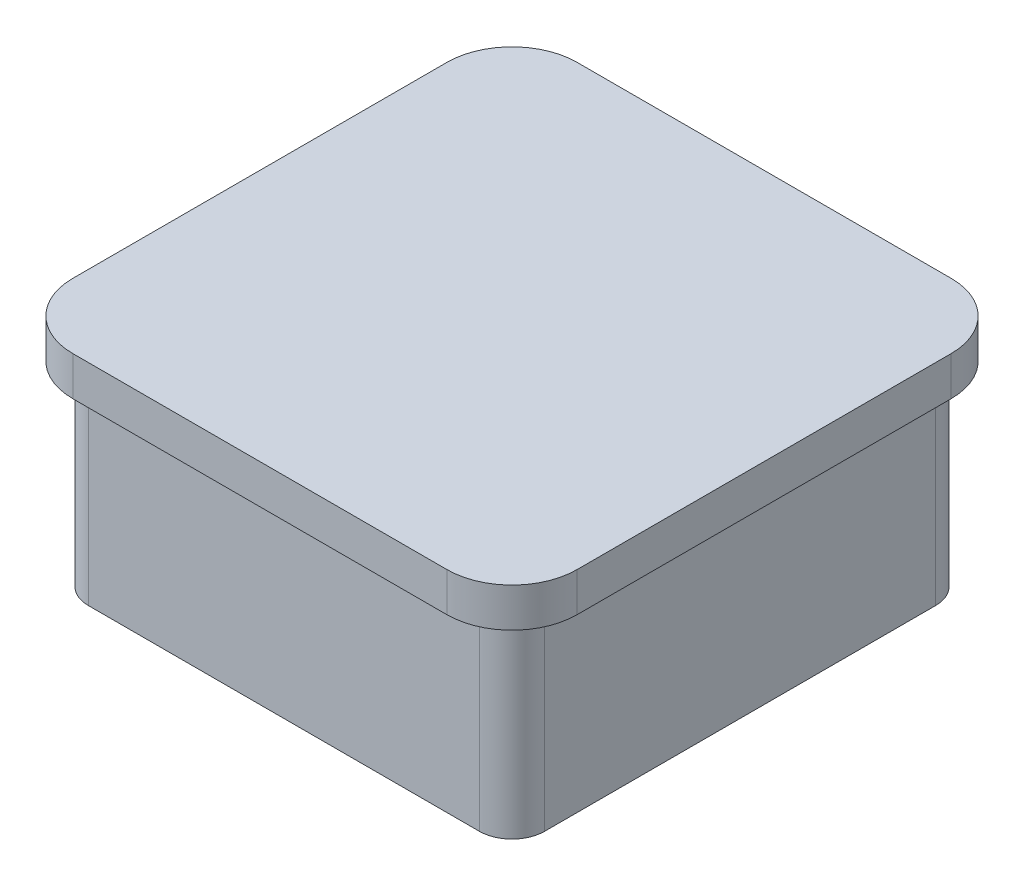
from build123d import *

# Parameters (mm, degrees)
SZKIC1_W                    = 77.4
SZKIC1_H                    = 77.4
DODANIE_WYCI_GNI_CIE1_DEPTH = 6
DODANIE_WYCI_GNI_CIE2_DEPTH = 30
ZAOKR_GLENIE1_R             = 10


with BuildPart() as part:
    # Szkic1 → Dodanie-wyciągnięcie1 (new body)
    with BuildSketch(Plane(origin=(0, 0, 0), x_dir=(1, 0, 0), z_dir=(0, 1, 0))):
        Rectangle(SZKIC1_W, SZKIC1_H)
    extrude(amount=-DODANIE_WYCI_GNI_CIE1_DEPTH)

    # Szkic2 → Dodanie-wyciągnięcie2 (add)
    with BuildSketch(Plane.XZ.offset(6)):
        with BuildLine():
            Line((-30, -35), (30, -35))
            ThreePointArc((30, -35), (33.535533906, -33.535533906), (35, -30))
            Line((35, -30), (35, 30))
            ThreePointArc((35, 30), (33.535533906, 33.535533906), (30, 35))
            Line((30, 35), (-30, 35))
            ThreePointArc((-30, 35), (-33.535533906, 33.535533906), (-35, 30))
            Line((-35, 30), (-35, -30))
            ThreePointArc((-35, -30), (-33.535533906, -33.535533906), (-30, -35))
        make_face()
        with BuildLine():
            Line((-33, -30), (-33, 30))
            ThreePointArc((-33, 30), (-32.121320344, 32.121320344), (-30, 33))
            Line((-30, 33), (30, 33))
            ThreePointArc((30, 33), (32.121320344, 32.121320344), (33, 30))
            Line((33, 30), (33, -30))
            ThreePointArc((33, -30), (32.121320344, -32.121320344), (30, -33))
            Line((30, -33), (-30, -33))
            ThreePointArc((-30, -33), (-32.121320344, -32.121320344), (-33, -30))
        make_face(mode=Mode.SUBTRACT)
    extrude(amount=DODANIE_WYCI_GNI_CIE2_DEPTH)

    # Zaokrąglenie1
    zaokr_glenie1_edges = [part.edges().sort_by_distance(p)[0] for p in [
        (38.7, -3, 38.7),
        (-38.7, -3, 38.7),
        (-38.7, -3, -38.7),
        (38.7, -3, -38.7),
    ]]
    fillet(zaokr_glenie1_edges, radius=ZAOKR_GLENIE1_R)


solid = part.part
